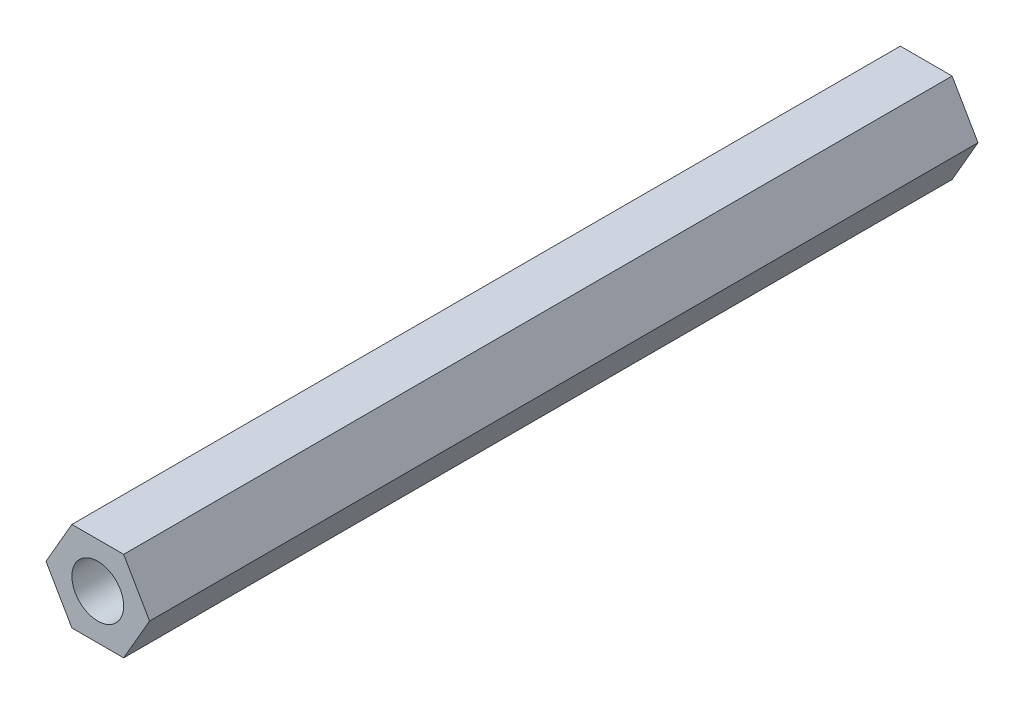
from build123d import *

# Parameters (mm, degrees)
EXTRUDE_1_DEPTH    = 40
HOLE_WIZARD_M3_1_D = 2.5


with BuildPart() as part:
    # 草图1 → 凸台-拉伸1 (new body)
    with BuildSketch(Plane.XY):
        Polygon((0, 0), (2.5, 0), (3.75, -2.165063509), (2.5, -4.330127019), (0, -4.330127019), (-1.25, -2.165063509), align=None)
    extrude(amount=EXTRUDE_1_DEPTH)

    # M3 螺纹孔1 (through all)
    with Locations(Plane.XY.offset(40)):
        with Locations((1.25, -2.165063509)):
            Hole(HOLE_WIZARD_M3_1_D / 2)


solid = part.part
